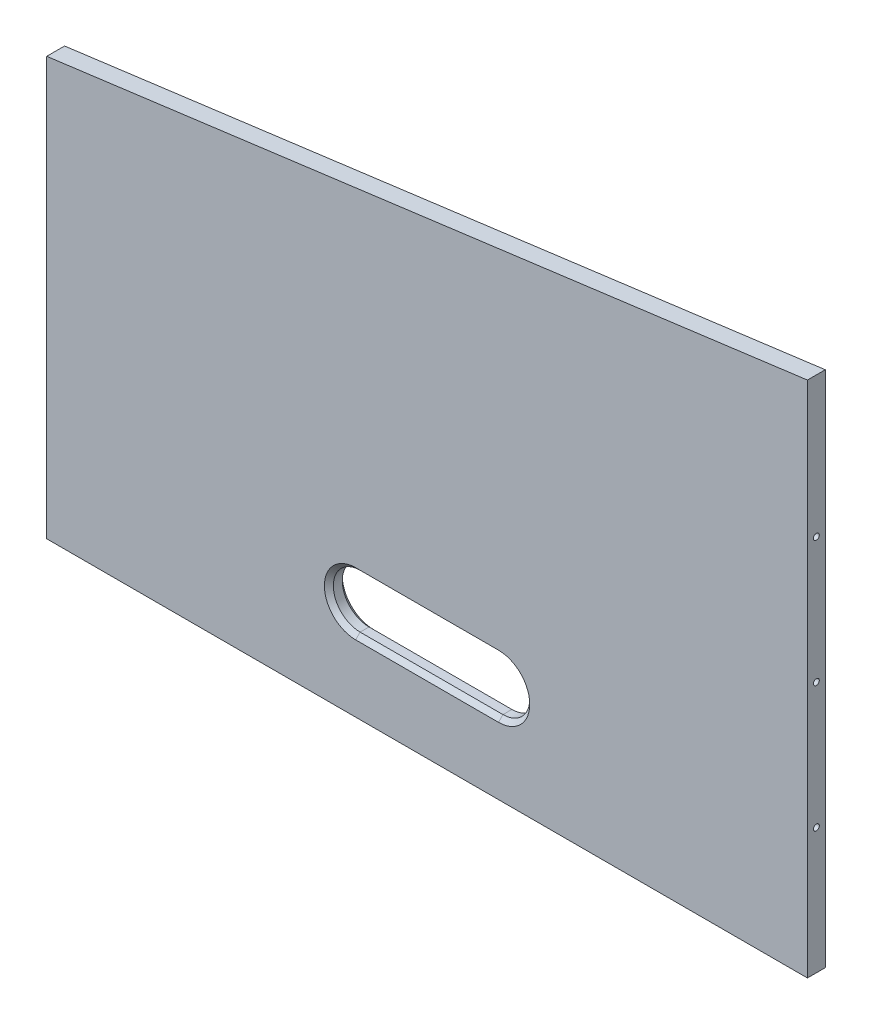
from build123d import *

# Parameters (mm, degrees)
BOSS_EXTRUDE1_DEPTH       = 10
CUT_EXTRUDE1_DEPTH        = 516.437678095
CHAMFER1_SIZE             = 2.5
M4X0_7_TAPPED_HOLE1_D     = 3.3
M4X0_7_TAPPED_HOLE1_DEPTH = 12
M4X0_7_TAPPED_HOLE1_TIP   = 0.991420021
M4X0_7_TAPPED_HOLE2_D     = 3.3
M4X0_7_TAPPED_HOLE2_DEPTH = 12
M4X0_7_TAPPED_HOLE2_TIP   = 0.991420021
M4X0_7_TAPPED_HOLE3_D     = 3.3
M4X0_7_TAPPED_HOLE3_DEPTH = 12
M4X0_7_TAPPED_HOLE3_TIP   = 0.991420021


with BuildPart() as part:
    # Sketch1 → Boss-Extrude1 (new body)
    with BuildSketch(Plane.XY):
        Polygon((0, 234), (0, 290), (-426, 234), (-426, 0), (0, 0), align=None)
    extrude(amount=BOSS_EXTRUDE1_DEPTH)

    # Sketch2 → Cut-Extrude1 (cut, through all)
    with BuildSketch(Plane(origin=(0, 0, 0), x_dir=(-1, 0, 0), z_dir=(0, 0, -1))):
        with BuildLine():
            Line((173, 70), (253, 70))
            ThreePointArc((253, 70), (268, 55), (253, 40))
            Line((253, 40), (173, 40))
            ThreePointArc((173, 40), (158, 55), (173, 70))
        make_face()
    extrude(amount=-CUT_EXTRUDE1_DEPTH, mode=Mode.SUBTRACT)

    # Chamfer1
    chamfer1_edges = [part.edges().sort_by_distance(p)[0] for p in [
        (-268, 55, 10),
        (-213, 40, 10),
        (-158, 55, 10),
        (-213, 70, 10),
        (-268, 55, 0),
        (-213, 70, 0),
        (-158, 55, 0),
        (-213, 40, 0),
    ]]
    chamfer(chamfer1_edges, length=CHAMFER1_SIZE)

    # M4x0.7 Tapped Hole1
    with Locations(Plane(origin=(0, 0, 0), x_dir=(-1, 0, 0), z_dir=(0, -1, 0))):
        with Locations((63, -5), (213, -5), (363, -5)):
            Hole(M4X0_7_TAPPED_HOLE1_D / 2, depth=M4X0_7_TAPPED_HOLE1_DEPTH)
            with Locations((0, 0, -(M4X0_7_TAPPED_HOLE1_DEPTH + M4X0_7_TAPPED_HOLE1_TIP / 2))):  # 118° drill point
                Cone(0, M4X0_7_TAPPED_HOLE1_D / 2, M4X0_7_TAPPED_HOLE1_TIP, mode=Mode.SUBTRACT)

    # M4x0.7 Tapped Hole2
    with Locations(Plane.ZY.offset(426)):
        with Locations((5, 70.5), (5, 141), (5, 211.5)):
            Hole(M4X0_7_TAPPED_HOLE2_D / 2, depth=M4X0_7_TAPPED_HOLE2_DEPTH)
            with Locations((0, 0, -(M4X0_7_TAPPED_HOLE2_DEPTH + M4X0_7_TAPPED_HOLE2_TIP / 2))):  # 118° drill point
                Cone(0, M4X0_7_TAPPED_HOLE2_D / 2, M4X0_7_TAPPED_HOLE2_TIP, mode=Mode.SUBTRACT)

    # M4x0.7 Tapped Hole3
    with Locations(Plane(origin=(0, 0, 0), x_dir=(0, 0, -1), z_dir=(1, 0, 0))):
        with Locations((-5, 70.5), (-5, 141), (-5, 211.5)):
            Hole(M4X0_7_TAPPED_HOLE3_D / 2, depth=M4X0_7_TAPPED_HOLE3_DEPTH)
            with Locations((0, 0, -(M4X0_7_TAPPED_HOLE3_DEPTH + M4X0_7_TAPPED_HOLE3_TIP / 2))):  # 118° drill point
                Cone(0, M4X0_7_TAPPED_HOLE3_D / 2, M4X0_7_TAPPED_HOLE3_TIP, mode=Mode.SUBTRACT)


solid = part.part
